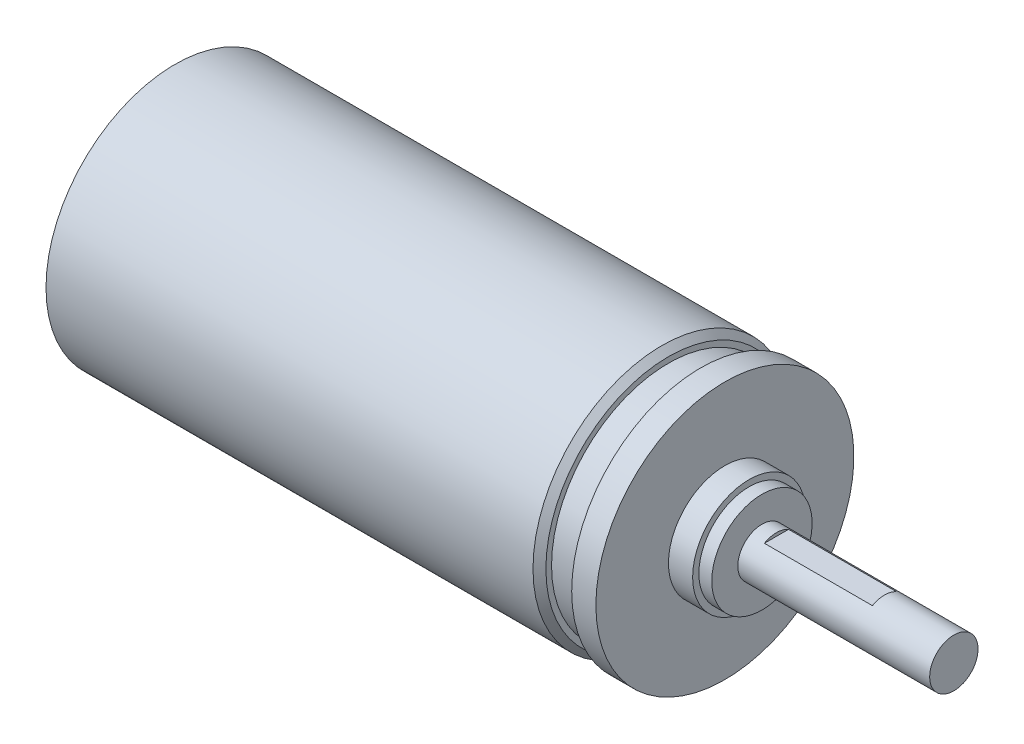
from build123d import *

# Parameters (mm, degrees)
CHANFREIN1_SIZE       = 0.4
EXTRUSION1_DEPTH      = 29.380374565
EXTRUSION1_DEPTH_BACK = 29.380374565
ESQUISSE2_W           = 6.7
ESQUISSE2_H           = 0.2


with BuildPart() as part:
    # Esquisse1 → Révolution1 (revolve)
    with BuildSketch(Plane.XY, mode=Mode.PRIVATE) as r_volution1_sk:
        Polygon((-22.272213686, 0), (-22.272213686, 8), (8.327786314, 8), (8.327786314, 7.25), (10.327786314, 7.25), (10.327786314, 8), (11.827786314, 8), (11.827786314, 3.5), (13.327786314, 3.5), (13.327786314, 3.111665859), (14.127786314, 3.111665859), (14.127786314, 1.5), (26.027786314, 1.5), (26.027786314, 0), align=None)
    revolve(r_volution1_sk.sketch.rotate(Axis((-64.659997946, 0, 0), (1, 0, 0)), 90), axis=Axis((-64.659997946, 0, 0), (1, 0, 0)))

    # Chanfrein1
    chanfrein1_edges = [part.edges().sort_by_distance(p)[0] for p in [
        (8.327786314, 0, -8),
    ]]
    chamfer(chanfrein1_edges, length=CHANFREIN1_SIZE)

    # Esquisse2 → Extrusion1 (cut, two sides: drawn at the far end of the back side and taken through both)
    with BuildSketch(Plane.XY.offset(-EXTRUSION1_DEPTH_BACK)):
        with Locations((18.377786314, 1.4)):
            Rectangle(ESQUISSE2_W, ESQUISSE2_H)
    extrude(amount=EXTRUSION1_DEPTH + EXTRUSION1_DEPTH_BACK, mode=Mode.SUBTRACT)


solid = part.part
